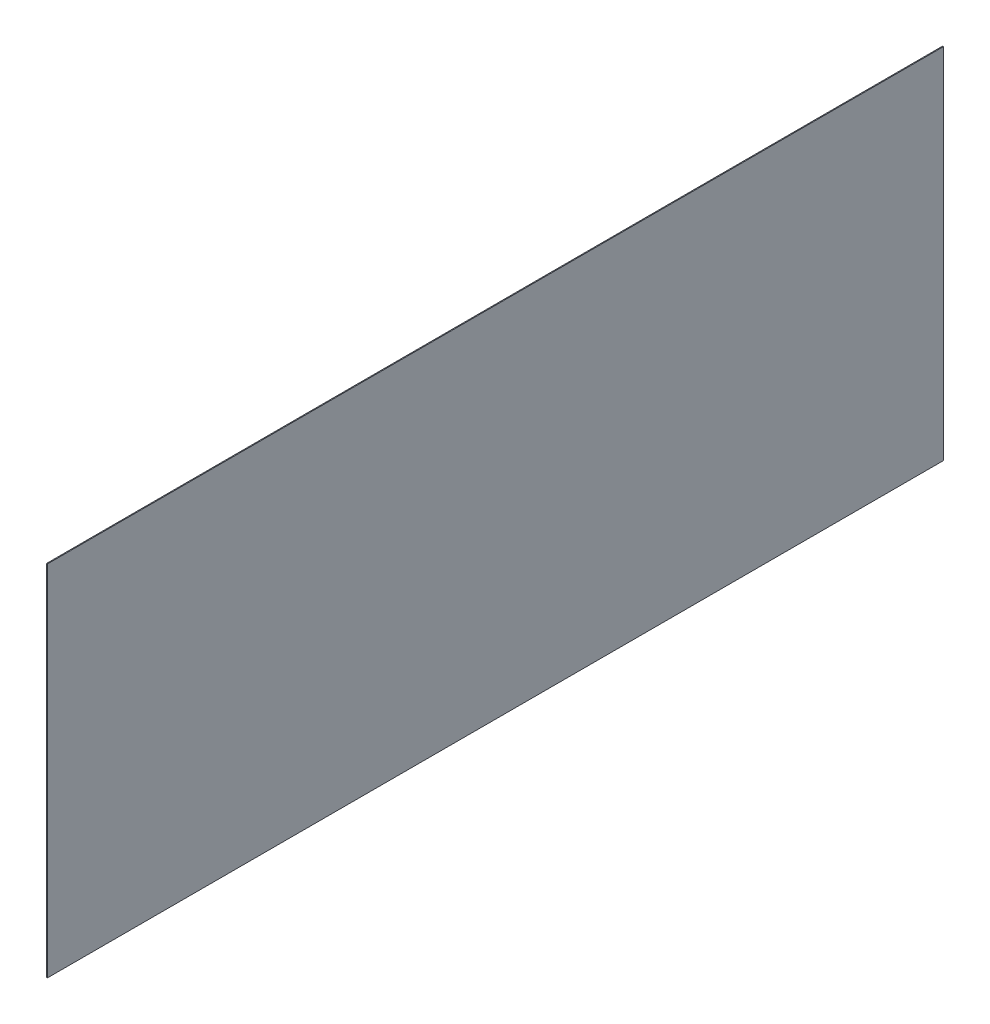
from build123d import *

# Parameters (mm, degrees)
CROQUIS1_W              = 100
CROQUIS1_H              = 40
SALIENTE_EXTRUIR1_DEPTH = 0.1


with BuildPart() as part:
    # Croquis1 → Saliente-Extruir1 (new body)
    with BuildSketch(Plane(origin=(0, 0, 0), x_dir=(0, 0, -1), z_dir=(1, 0, 0))):
        with Locations((50, 20)):
            Rectangle(CROQUIS1_W, CROQUIS1_H)
    extrude(amount=SALIENTE_EXTRUIR1_DEPTH)


solid = part.part
